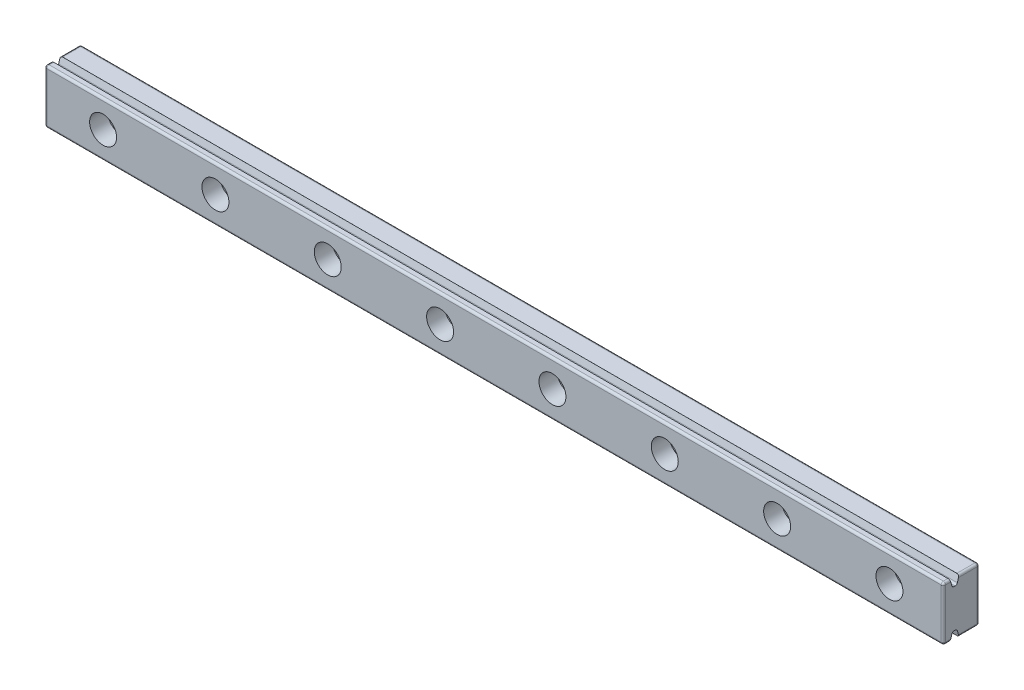
from build123d import *
from OCP.BRepFilletAPI import BRepFilletAPI_MakeChamfer

# Parameters (mm, degrees)
BOSS_EXTRUDE1_DEPTH = 200
SKETCH2_R           = 1.75
CUT_EXTRUDE1_DEPTH  = 10
SKETCH3_R           = 3
CUT_EXTRUDE2_DEPTH  = 4
CHAMFER1_SIZE       = 0.5
CHAMFER1_SIZE2      = 1.743707222
FILLET1_R           = 0.5


with BuildPart() as part:
    # Sketch1 → Boss-Extrude1 (new body)
    with BuildSketch(Plane(origin=(0, 0, 0), x_dir=(0, 0, -1), z_dir=(1, 0, 0))):
        Polygon((-0.5, 6), (4, 6), (4, -6), (-0.5, -6), (-0.5, -4.25), (-2.5, -4.25), (-2.5, -6), (-4, -6), (-4, 6), (-2.5, 6), (-2.5, 4.25), (-0.5, 4.25), align=None)
    extrude(amount=BOSS_EXTRUDE1_DEPTH)

    # Sketch2 → Cut-Extrude1 (cut)
    with BuildSketch(Plane.XY.offset(4)):
        with Locations((13, 0)):
            Circle(SKETCH2_R)
        with Locations((38, 0)):
            Circle(SKETCH2_R)
        with Locations((63, 0)):
            Circle(SKETCH2_R)
        with Locations((88, 0)):
            Circle(SKETCH2_R)
        with Locations((113, 0)):
            Circle(SKETCH2_R)
        with Locations((138, 0)):
            Circle(SKETCH2_R)
        with Locations((163, 0)):
            Circle(SKETCH2_R)
        with Locations((188, 0)):
            Circle(SKETCH2_R)
        with Locations((213, 0)):
            Circle(SKETCH2_R)
        with Locations((238, 0)):
            Circle(SKETCH2_R)
        with Locations((263, 0)):
            Circle(SKETCH2_R)
        with Locations((288, 0)):
            Circle(SKETCH2_R)
        with Locations((313, 0)):
            Circle(SKETCH2_R)
        with Locations((338, 0)):
            Circle(SKETCH2_R)
        with Locations((363, 0)):
            Circle(SKETCH2_R)
        with Locations((388, 0)):
            Circle(SKETCH2_R)
        with Locations((413, 0)):
            Circle(SKETCH2_R)
        with Locations((438, 0)):
            Circle(SKETCH2_R)
    extrude(amount=-CUT_EXTRUDE1_DEPTH, mode=Mode.SUBTRACT)

    # Sketch3 → Cut-Extrude2 (cut)
    with BuildSketch(Plane.XY.offset(4)):
        with Locations((13, 0)):
            Circle(SKETCH3_R)
        with Locations((38, 0)):
            Circle(SKETCH3_R)
        with Locations((63, 0)):
            Circle(SKETCH3_R)
        with Locations((88, 0)):
            Circle(SKETCH3_R)
        with Locations((113, 0)):
            Circle(SKETCH3_R)
        with Locations((138, 0)):
            Circle(SKETCH3_R)
        with Locations((163, 0)):
            Circle(SKETCH3_R)
        with Locations((188, 0)):
            Circle(SKETCH3_R)
        with Locations((213, 0)):
            Circle(SKETCH3_R)
        with Locations((238, 0)):
            Circle(SKETCH3_R)
        with Locations((263, 0)):
            Circle(SKETCH3_R)
        with Locations((288, 0)):
            Circle(SKETCH3_R)
        with Locations((313, 0)):
            Circle(SKETCH3_R)
        with Locations((338, 0)):
            Circle(SKETCH3_R)
        with Locations((363, 0)):
            Circle(SKETCH3_R)
        with Locations((388, 0)):
            Circle(SKETCH3_R)
        with Locations((413, 0)):
            Circle(SKETCH3_R)
        with Locations((438, 0)):
            Circle(SKETCH3_R)
    extrude(amount=-CUT_EXTRUDE2_DEPTH, mode=Mode.SUBTRACT)

    # Chamfer1: one chamfer whose edges measure the first distance from different faces: ONE call of the kernel's chamfer builder (chamfer() names one face for all edges)
    chamfer1_edges_1 = [part.edges().sort_by_distance(p)[0] for p in [
        (100, -4.25, 0.5),
        (100, -4.25, 2.5),
    ]]
    chamfer1_side_1 = [part.faces().sort_by_distance(p)[0] for p in [
        (100, -4.25, 1.5),
    ]]
    chamfer1_edges_2 = [part.edges().sort_by_distance(p)[0] for p in [
        (100, 4.25, 2.5),
        (100, 4.25, 0.5),
    ]]
    chamfer1_side_2 = [part.faces().sort_by_distance(p)[0] for p in [
        (100, 4.25, 1.5),
    ]]
    chamfer1 = BRepFilletAPI_MakeChamfer(part.part.solid().wrapped)
    for e in chamfer1_edges_1:
        chamfer1.Add(CHAMFER1_SIZE, CHAMFER1_SIZE2, e.wrapped, chamfer1_side_1[0].wrapped)  # the first distance lies on this face
    for e in chamfer1_edges_2:
        chamfer1.Add(CHAMFER1_SIZE, CHAMFER1_SIZE2, e.wrapped, chamfer1_side_2[0].wrapped)  # the first distance lies on this face
    add(Compound.cast(chamfer1.Shape()), mode=Mode.REPLACE)

    # Fillet1
    fillet1_edges = [part.edges().sort_by_distance(p)[0] for p in [
        (200, -6, -1.75),
        (200, 0, -4),
        (200, 6, -1.75),
        (200, 6, 3.25),
        (200, 0, 4),
        (200, -6, 3.25),
        (0, -6, 3.25),
        (0, -6, -1.75),
        (0, 0, -4),
        (0, 6, -1.75),
        (0, 6, 3.25),
        (0, 0, 4),
        (100, -4.25, 1),
        (100, -4.25, 2),
        (100, 4.25, 2),
        (100, 4.25, 1),
        (100, -6, 4),
        (100, 6, 4),
        (100, -6, -4),
        (100, 6, -4),
    ]]
    fillet(fillet1_edges, radius=FILLET1_R)


solid = part.part
